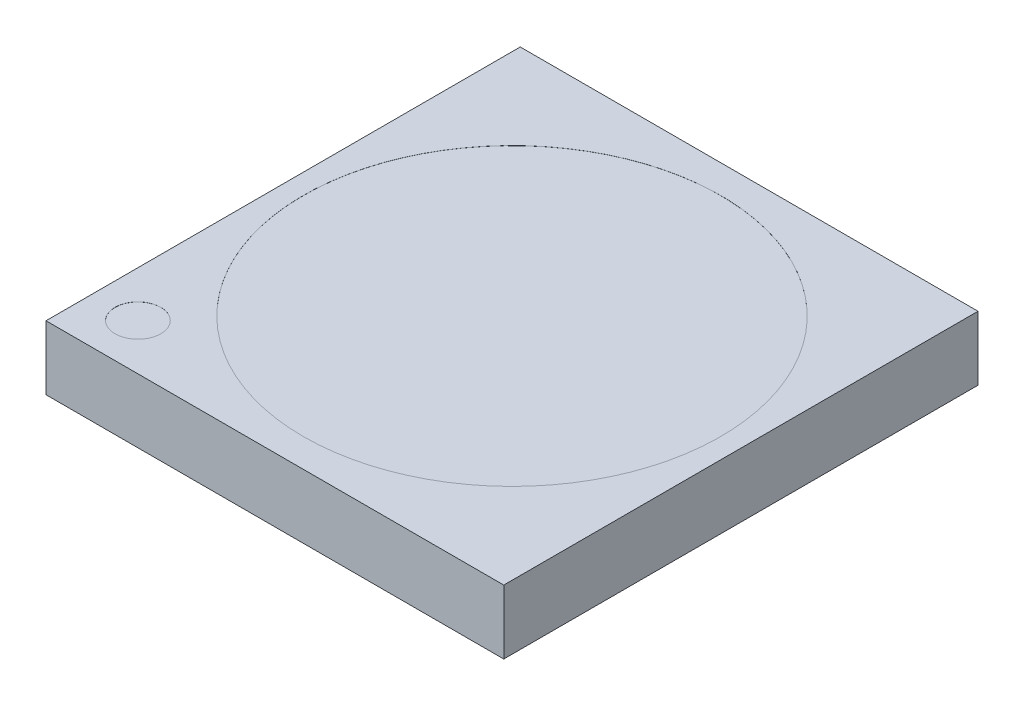
from build123d import *

# Parameters (mm, degrees)
SKETCH1_W      = 5
SKETCH1_H      = 5.18
EXTRUDE1_DEPTH = 0.7
EXTRUDE2_DEPTH = 0.001
EXTRUDE3_DEPTH = 0.001
SKETCH4_W      = 2.28
SKETCH4_H      = 0.001
SKETCH5_W      = 0.25
SKETCH5_H      = 0.001
FILLET1_R      = 0.05
FILLET2_R      = 0.5


with BuildPart() as part:
    # Sketch1 → Extrude1 (new body)
    with BuildSketch(Plane.XZ):
        Rectangle(SKETCH1_W, SKETCH1_H)
    extrude(amount=-EXTRUDE1_DEPTH)

    # Sketch2 → Extrude2 (cut)
    with BuildSketch(Plane.XZ):
        with BuildLine():
            Line((-0.3, 0.18), (-0.3, 2.27))
            Line((-0.3, 2.27), (-1.347150109, 2.27))
            ThreePointArc((-1.347150109, 2.27), (-1.484109573, 2.206799423), (-1.52489218, 2.061578947))
            ThreePointArc((-1.52489218, 2.061578947), (-1.61548587, 1.744341189), (-1.916842105, 1.610060023))
            ThreePointArc((-1.916842105, 1.610060023), (-2.046157796, 1.558478577), (-2.1, 1.430087726))
            Line((-2.1, 1.430087726), (-2.1, -1.430087726))
            ThreePointArc((-2.1, -1.430087726), (-2.047279221, -1.557366947), (-1.92, -1.610087726))
            ThreePointArc((-1.92, -1.610087726), (-1.918420992, -1.6100808), (-1.916842105, -1.610060023))
            ThreePointArc((-1.916842105, -1.610060023), (-1.61548587, -1.744341189), (-1.52489218, -2.061578947))
            ThreePointArc((-1.52489218, -2.061578947), (-1.484109573, -2.206799423), (-1.347150109, -2.27))
            Line((-1.347150109, -2.27), (-0.3, -2.27))
            Line((-0.3, -2.27), (-0.3, -0.18))
            ThreePointArc((-0.3, -0.18), (-0.48, 0), (-0.3, 0.18))
        make_face()
    extrude(amount=-EXTRUDE2_DEPTH, mode=Mode.SUBTRACT)

    # Sketch3 → Extrude3 (cut)
    with BuildSketch(Plane.XZ):
        with BuildLine():
            Line((1.347150109, 2.27), (0.3, 2.27))
            Line((0.3, 2.27), (0.3, -2.27))
            Line((0.3, -2.27), (1.347150109, -2.27))
            ThreePointArc((1.347150109, -2.27), (1.484109573, -2.206799423), (1.52489218, -2.061578947))
            ThreePointArc((1.52489218, -2.061578947), (1.61548587, -1.744341189), (1.916842105, -1.610060023))
            ThreePointArc((1.916842105, -1.610060023), (1.918420992, -1.6100808), (1.92, -1.610087726))
            ThreePointArc((1.92, -1.610087726), (2.047279221, -1.557366947), (2.1, -1.430087726))
            Line((2.1, -1.430087726), (2.1, 1.430087726))
            ThreePointArc((2.1, 1.430087726), (2.046157796, 1.558478577), (1.916842105, 1.610060023))
            ThreePointArc((1.916842105, 1.610060023), (1.61548587, 1.744341189), (1.52489218, 2.061578947))
            ThreePointArc((1.52489218, 2.061578947), (1.484109573, 2.206799423), (1.347150109, 2.27))
        make_face()
    extrude(amount=-EXTRUDE3_DEPTH, mode=Mode.SUBTRACT)

    # Sketch4 → Cut-Revolve1 (revolve, cut)
    with BuildSketch(Plane(origin=(0, 0, 0), x_dir=(-1, 0, 0), z_dir=(0, 0, -1)), mode=Mode.PRIVATE) as cut_revolve1_sk:
        with Locations((-1.14, 0.6995)):
            Rectangle(SKETCH4_W, SKETCH4_H)
    revolve(cut_revolve1_sk.sketch.rotate(Axis((0, 0.699, 0), (0, 1, 0)), 270), axis=Axis((0, 0.699, 0), (0, 1, 0)), mode=Mode.SUBTRACT)

    # Sketch5 → Cut-Revolve2 (revolve, cut)
    with BuildSketch(Plane(origin=(0, 0, 2.086), x_dir=(-1, 0, 0), z_dir=(0, 0, -1)), mode=Mode.PRIVATE) as cut_revolve2_sk:
        with Locations((1.875, 0.6995)):
            Rectangle(SKETCH5_W, SKETCH5_H)
    revolve(cut_revolve2_sk.sketch.rotate(Axis((-2, 0.699, 2.086), (0, 1, 0)), 270), axis=Axis((-2, 0.699, 2.086), (0, 1, 0)), mode=Mode.SUBTRACT)

    # Fillet1
    fillet1_edges = [part.edges().sort_by_distance(p)[0] for p in [
        (-0.3, 0.0005, 0.18),
        (-0.3, 0.0005, -0.18),
    ]]
    fillet(fillet1_edges, radius=FILLET1_R)

    # Fillet2
    fillet2_edges = [part.edges().sort_by_distance(p)[0] for p in [
        (-0.3, 0.0005, -2.27),
        (-0.3, 0.0005, 2.27),
        (0.3, 0.0005, -2.27),
        (0.3, 0.0005, 2.27),
    ]]
    fillet(fillet2_edges, radius=FILLET2_R)


solid = part.part
